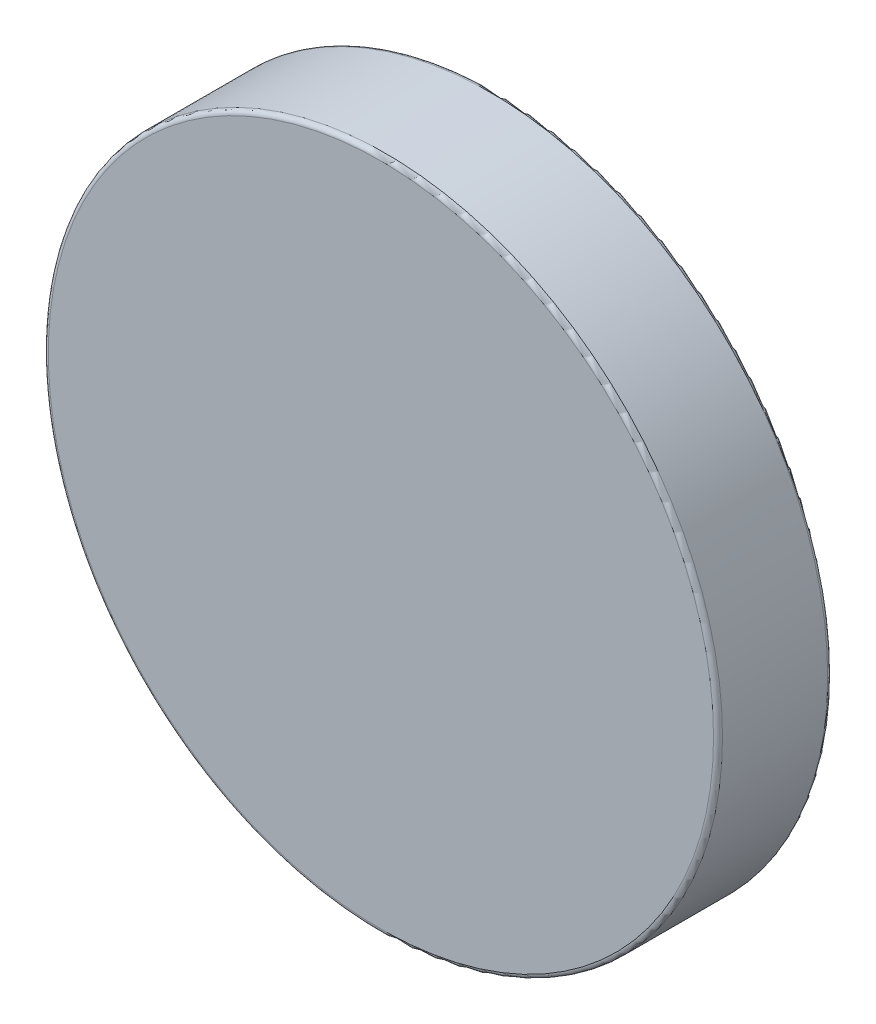
from build123d import *

# Parameters (mm, degrees)
ESQUISSE1_R        = 75
BOSS_EXTRU_1_DEPTH = 25.4
CONG_1_R           = 1
CONG_2_R           = 1


with BuildPart() as part:
    # Esquisse1 → Boss.-Extru.1 (new body)
    with BuildSketch(Plane.XY):
        Circle(ESQUISSE1_R)
    extrude(amount=BOSS_EXTRU_1_DEPTH)

    # Congé1
    cong_1_edges = [part.edges().sort_by_distance(p)[0] for p in [
        (-75, 0, 25.4),
    ]]
    fillet(cong_1_edges, radius=CONG_1_R)

    # Congé2
    cong_2_edges = [part.edges().sort_by_distance(p)[0] for p in [
        (-75, 0, 0),
    ]]
    fillet(cong_2_edges, radius=CONG_2_R)


solid = part.part
